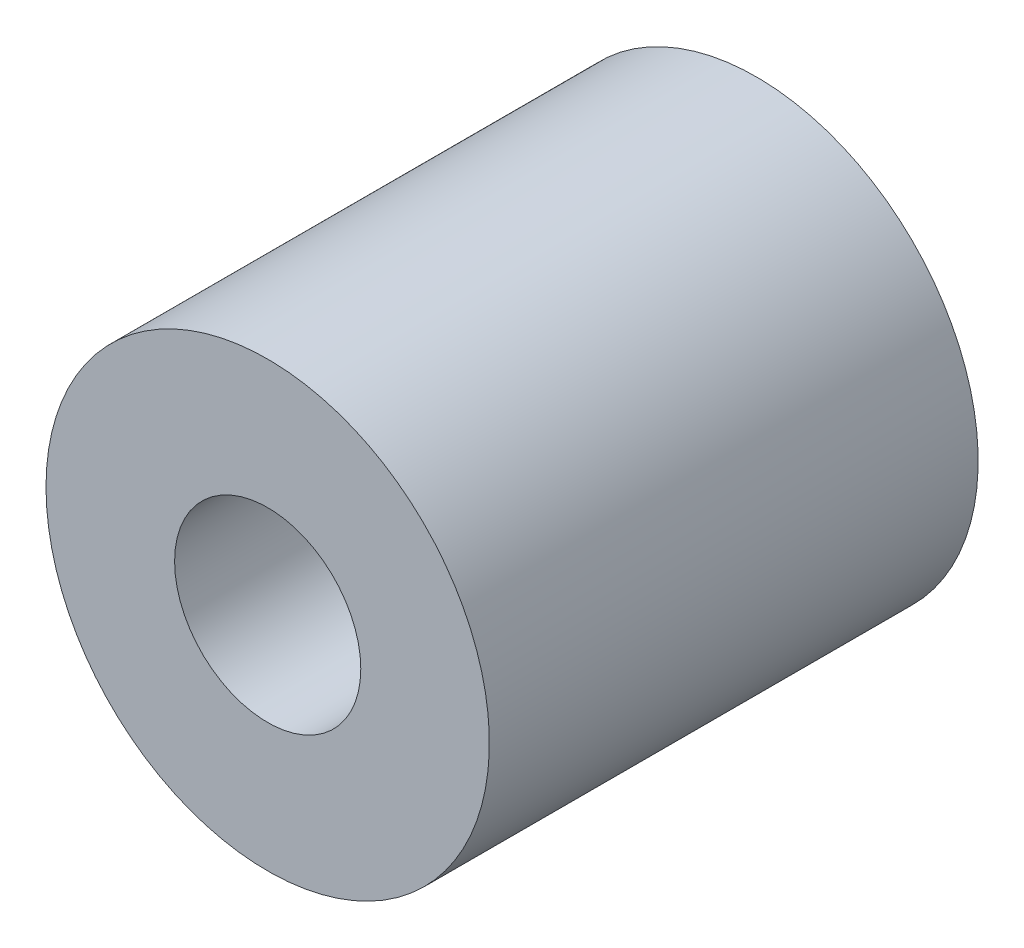
from build123d import *

# Parameters (mm, degrees)
SKETCH1_R           = 9.525
SKETCH1_R_2         = 4
BOSS_EXTRUDE1_DEPTH = 21


with BuildPart() as part:
    # Sketch1 → Boss-Extrude1 (new body)
    with BuildSketch(Plane.XY):
        with Locations(Location((0, 0, 0), (0, 0, 180))):
            Circle(SKETCH1_R)
        with Locations(Location((0, 0, 0), (0, 0, 180))):
            Circle(SKETCH1_R_2, mode=Mode.SUBTRACT)
    extrude(amount=BOSS_EXTRUDE1_DEPTH)


solid = part.part
